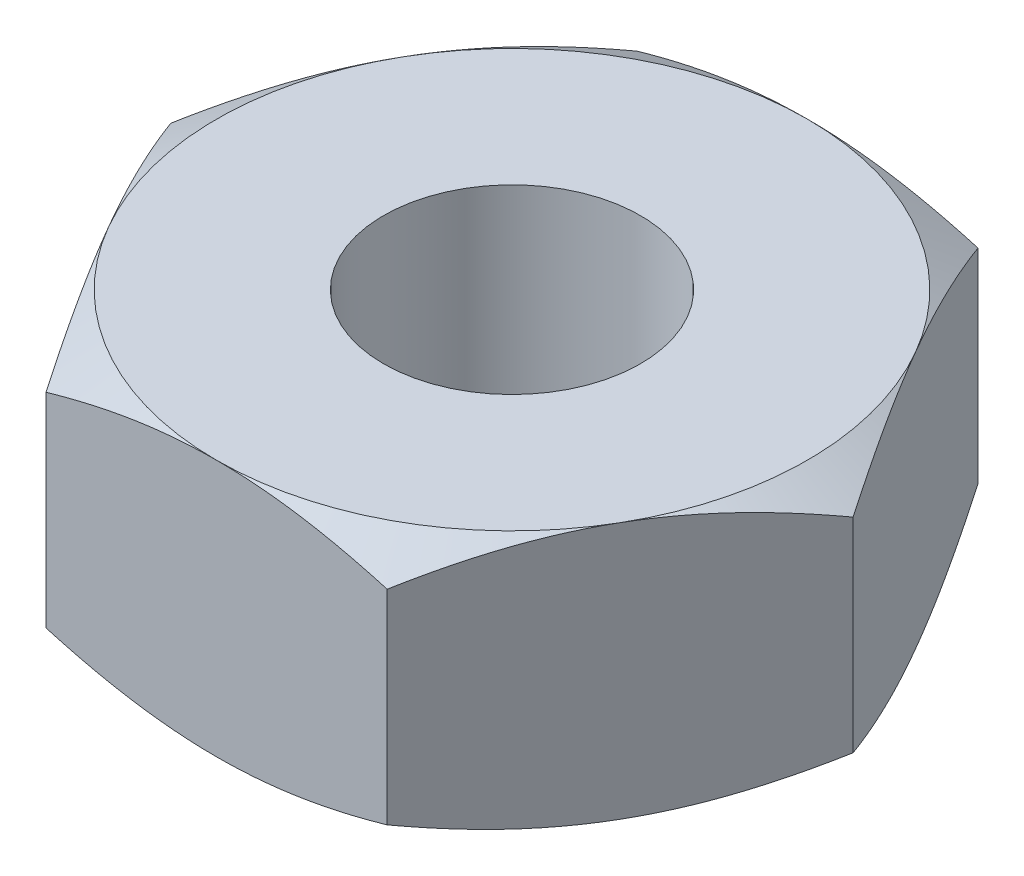
from build123d import *

# Parameters (mm, degrees)
BOSS_EXTRUDE1_DEPTH   = 5
SKETCH2_OUTSIDE_W     = 36.254
SKETCH2_OUTSIDE_H     = 34.474
SKETCH2_OUTSIDE_R     = 5.75
CUT_EXTRUDE1_DEPTH    = 5
CUT_EXTRUDE1_DRAFT    = -60
SKETCH3_OUTSIDE_W     = 36.254
SKETCH3_OUTSIDE_H     = 34.474
SKETCH3_OUTSIDE_R     = 5.75
CUT_EXTRUDE2_DEPTH    = 5
CUT_EXTRUDE2_DRAFT    = -60
M6_TAPPED_HOLE1_D     = 5
M6_TAPPED_HOLE1_DEPTH = 17


with BuildPart() as part:
    # Sketch1 → Boss-Extrude1 (new body)
    with BuildSketch(Plane(origin=(0, 0, 0), x_dir=(1, 0, 0), z_dir=(0, 1, 0))):
        Polygon((6.639528096, 0), (3.319764048, 5.75), (-3.319764048, 5.75), (-6.639528096, 0), (-3.319764048, -5.75), (3.319764048, -5.75), align=None)
    extrude(amount=BOSS_EXTRUDE1_DEPTH)


with BuildPart() as cut_extrude1_tool:
    # Sketch2 outside → Cut-Extrude1 (with draft: the straight prism first)
    with BuildSketch(Plane(origin=(0, 5, 0), x_dir=(1, 0, 0), z_dir=(0, 1, 0))):
        Rectangle(SKETCH2_OUTSIDE_W, SKETCH2_OUTSIDE_H)
        Circle(SKETCH2_OUTSIDE_R, mode=Mode.SUBTRACT)
    extrude(amount=-CUT_EXTRUDE1_DEPTH)
    # Cut-Extrude1: the draft: its side faces are tilted about the plane it starts from
    cut_extrude1_sides = [cut_extrude1_tool.faces().sort_by_distance(p)[0] for p in [
        (0, 2.5, 17.237),
        (18.127, 2.5, 0),
        (0, 2.5, -17.237),
        (-18.127, 2.5, 0),
        (-5.75, 2.5, 0),
    ]]
    draft(cut_extrude1_sides, Plane(origin=(0, 5, 0), x_dir=(1, 0, 0), z_dir=(0, 1, 0)), CUT_EXTRUDE1_DRAFT)


with BuildPart() as part_1:
    add(part.part)

    # Cut-Extrude1: cut by cut_extrude1_tool
    add(cut_extrude1_tool.part, mode=Mode.SUBTRACT)


with BuildPart() as cut_extrude2_tool:
    # Sketch3 outside → Cut-Extrude2 (with draft: the straight prism first)
    with BuildSketch(Plane.XZ):
        Rectangle(SKETCH3_OUTSIDE_W, SKETCH3_OUTSIDE_H)
        Circle(SKETCH3_OUTSIDE_R, mode=Mode.SUBTRACT)
    extrude(amount=-CUT_EXTRUDE2_DEPTH)
    # Cut-Extrude2: the draft: its side faces are tilted about the plane it starts from
    cut_extrude2_sides = [cut_extrude2_tool.faces().sort_by_distance(p)[0] for p in [
        (0, 2.5, -17.237),
        (18.127, 2.5, 0),
        (0, 2.5, 17.237),
        (-18.127, 2.5, 0),
        (-5.75, 2.5, 0),
    ]]
    draft(cut_extrude2_sides, Plane.XZ, CUT_EXTRUDE2_DRAFT)


with BuildPart() as part_2:
    add(part_1.part)

    # Cut-Extrude2: cut by cut_extrude2_tool
    add(cut_extrude2_tool.part, mode=Mode.SUBTRACT)

    # M6 Tapped Hole1
    with Locations(Plane(origin=(0, 5, 0), x_dir=(1, 0, 0), z_dir=(0, 1, 0))):
        with Locations((0, 0)):
            Hole(M6_TAPPED_HOLE1_D / 2, depth=M6_TAPPED_HOLE1_DEPTH)


solid = part_2.part
